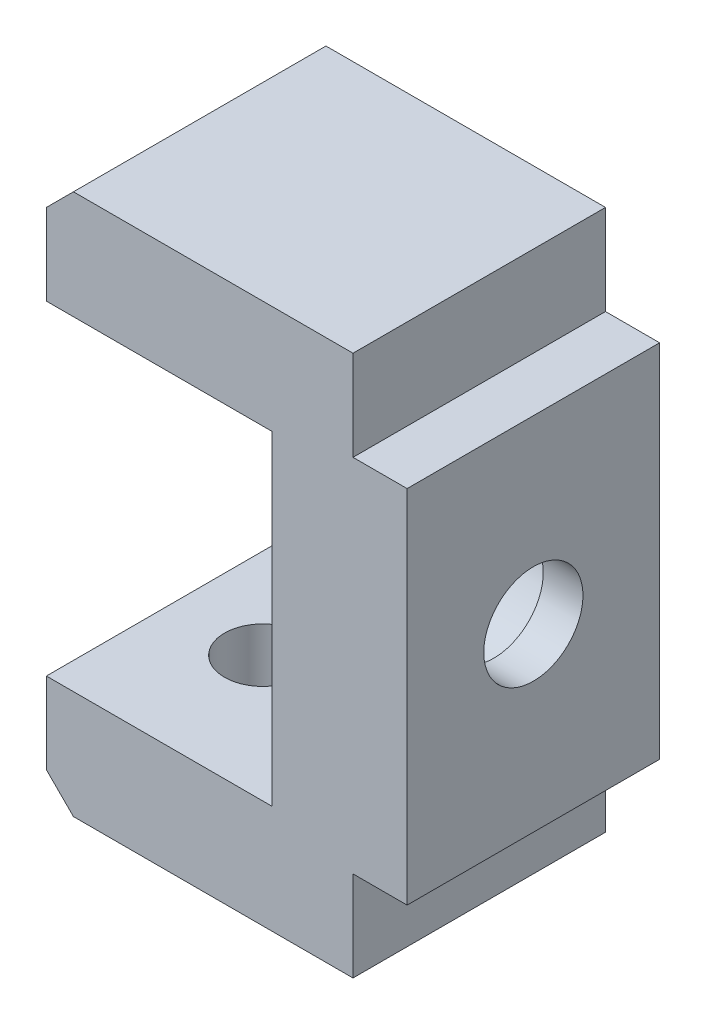
from build123d import *

# Parameters (mm, degrees)
BOSS_EXTRU_1_DEPTH                                 = 28
CHANFREIN1_SIZE                                    = 3
CHAMBRAGE_POUR_VIS_T_TE_HEXAGONALE_M10_D           = 11
CHAMBRAGE_POUR_VIS_T_TE_HEXAGONALE_M10_CBORE_D     = 18
CHAMBRAGE_POUR_VIS_T_TE_HEXAGONALE_M10_CBORE_DEPTH = 10.6


with BuildPart() as part:
    # Esquisse1 → Boss.-Extru.1 (new body)
    with BuildSketch(Plane.XY):
        Polygon((0, 0), (0, 10), (6, 10), (6, 50), (0, 50), (0, 60), (-34, 60), (-34, 48), (-9, 48), (-9, 12), (-34, 12), (-34, 0), align=None)
    extrude(amount=BOSS_EXTRU_1_DEPTH)

    # Chanfrein1
    chanfrein1_edges = [part.edges().sort_by_distance(p)[0] for p in [
        (-34, 0, 14),
        (-34, 60, 14),
    ]]
    chamfer(chanfrein1_edges, length=CHANFREIN1_SIZE)

    # Esquisse3 → Trou taraudé M101 (revolve, cut)
    with BuildSketch(Plane(origin=(-24, 12, 14), x_dir=(0, 0, 1), z_dir=(1, 0, 0))):
        Polygon((0, 0), (0, 12), (6, 12), (4.25, 10.989637029), (4.25, 0), align=None)
    revolve(axis=Axis((-24, 18.35, 14), (0, -1, 0)), mode=Mode.SUBTRACT)

    # Chambrage pour vis à tête hexagonale M101 (through all)
    with Locations(Plane.ZY.offset(9)):
        with Locations((14, 30)):
            CounterBoreHole(CHAMBRAGE_POUR_VIS_T_TE_HEXAGONALE_M10_D / 2, CHAMBRAGE_POUR_VIS_T_TE_HEXAGONALE_M10_CBORE_D / 2, CHAMBRAGE_POUR_VIS_T_TE_HEXAGONALE_M10_CBORE_DEPTH)


solid = part.part
